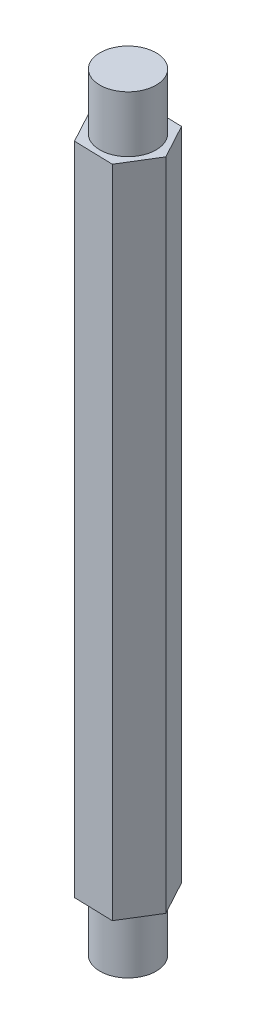
from build123d import *

# Parameters (mm, degrees)
SKETCH1_R           = 1.5
BOSS_EXTRUDE1_DEPTH = 3
BOSS_EXTRUDE2_DEPTH = 35
SKETCH3_R           = 1.5
BOSS_EXTRUDE3_DEPTH = 3


with BuildPart() as part:
    # Sketch1 → Boss-Extrude1 (new body)
    with BuildSketch(Plane(origin=(0, 0, 0), x_dir=(1, 0, 0), z_dir=(0, 1, 0))):
        with Locations(Location((0, 0, 0), (0, 0, 270))):
            Circle(SKETCH1_R)
    extrude(amount=BOSS_EXTRUDE1_DEPTH)

    # Sketch2 → Boss-Extrude2 (add)
    with BuildSketch(Plane(origin=(0, 3, 0), x_dir=(1, 0, 0), z_dir=(0, 1, 0))):
        Polygon((-0.98915483, 1.827996915), (-2.077669182, 0.057365247), (-1.088514352, -1.770631668), (0.98915483, -1.827996915), (2.077669182, -0.057365247), (1.088514352, 1.770631668), align=None)
    extrude(amount=BOSS_EXTRUDE2_DEPTH)

    # Sketch3 → Boss-Extrude3 (add)
    with BuildSketch(Plane(origin=(0, 38, 0), x_dir=(1, 0, 0), z_dir=(0, 1, 0))):
        with Locations(Location((0, 0, 0), (0, 0, 270))):
            Circle(SKETCH3_R)
    extrude(amount=BOSS_EXTRUDE3_DEPTH)


solid = part.part
